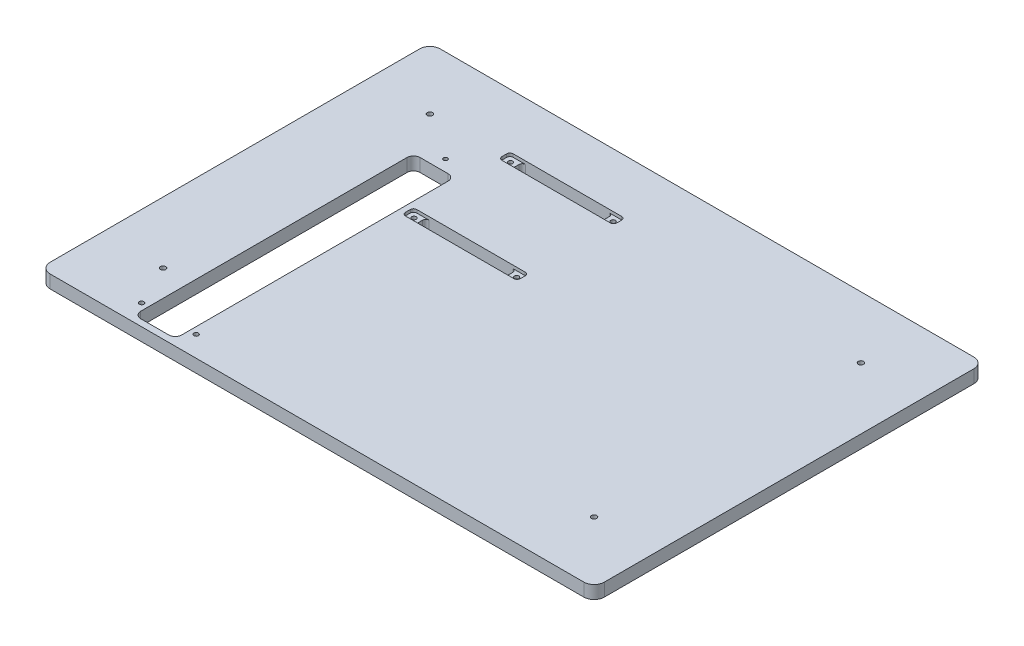
from build123d import *

# Parameters (mm, degrees)
BOSS_EXTRUDE1_DEPTH         = 12.7
TAP_DRILL_FOR_1_4_20_TAP1_D = 5.1054
SKETCH10_R                  = 2.25
SKETCH10_R_2                = 2.2
CUT_EXTRUDE1_DEPTH          = 331.395656751
CUT_EXTRUDE2_REACH          = 332.396
SKETCH11_W                  = 88
SKETCH11_H                  = 11
SKETCH12_W                  = 40
SKETCH12_H                  = 272.22
CUT_EXTRUDE3_DEPTH          = 331.395656751
SKETCH13_W                  = 12
SKETCH13_H                  = 11
CUT_EXTRUDE4_DEPTH          = 3
FILLET2_R                   = 6.35
FILLET3_R                   = 3.175
SKETCH14_R                  = 2
CUT_EXTRUDE5_DEPTH          = 331.395656751


with BuildPart() as part:
    # Sketch1 → Boss-Extrude1 (new body)
    with BuildSketch(Plane(origin=(0, 0, 0), x_dir=(1, 0, 0), z_dir=(0, 1, 0))):
        with BuildLine():
            Line((-260, 190), (260, 190))
            ThreePointArc((260, 190), (267.071067812, 187.071067812), (270, 180))
            Line((270, 180), (270, -180))
            ThreePointArc((270, -180), (267.071067812, -187.071067812), (260, -190))
            Line((260, -190), (-260, -190))
            ThreePointArc((-260, -190), (-267.071067812, -187.071067812), (-270, -180))
            Line((-270, -180), (-270, 180))
            ThreePointArc((-270, 180), (-267.071067812, 187.071067812), (-260, 190))
        make_face()
    extrude(amount=-BOSS_EXTRUDE1_DEPTH)

    # Tap Drill for 1/4-20 Tap1 (through all)
    with Locations(Plane(origin=(0, 0, 0), x_dir=(1, 0, 0), z_dir=(0, 1, 0))):
        with Locations((-210, 130), (-210, -130), (210, 130), (210, -130)):
            Hole(TAP_DRILL_FOR_1_4_20_TAP1_D / 2)

    # Sketch10 → Cut-Extrude1 (cut, through all)
    with BuildSketch(Plane(origin=(0, 0, 0), x_dir=(1, 0, 0), z_dir=(0, 1, 0))):
        with Locations(Location((-137.95, -169.854932, 0), (0, 0, 270))):
            Circle(SKETCH10_R)
        with Locations(Location((-191.05, -169.854932, 0), (0, 0, 270))):
            Circle(SKETCH10_R)
        with Locations(Location((-133, 131.522913005, 0), (0, 0, 270))):
            Circle(SKETCH10_R_2)
        with Locations(Location((-33, 131.522913005, 0), (0, 0, 270))):
            Circle(SKETCH10_R_2)
        with Locations(Location((-133, 37.522913005, 0), (0, 0, 270))):
            Circle(SKETCH10_R_2)
        with Locations(Location((-33, 37.522913005, 0), (0, 0, 270))):
            Circle(SKETCH10_R_2)
    extrude(amount=-CUT_EXTRUDE1_DEPTH, mode=Mode.SUBTRACT)

    # Sketch11 → Cut-Extrude2 (cut, up to next)
    with BuildSketch(Plane(origin=(0, 0, 0), x_dir=(1, 0, 0), z_dir=(0, 1, 0)), mode=Mode.PRIVATE) as cut_extrude2_sk1:
        with Locations((-83, 37.522913005)):
            Rectangle(SKETCH11_W, SKETCH11_H)
    cut_extrude2_tool1 = extrude(cut_extrude2_sk1.sketch, amount=-CUT_EXTRUDE2_REACH, mode=Mode.PRIVATE) & part.part
    # Sketch11 → Cut-Extrude2 (cut, up to next)
    with BuildSketch(Plane(origin=(0, 0, 0), x_dir=(1, 0, 0), z_dir=(0, 1, 0)), mode=Mode.PRIVATE) as cut_extrude2_sk2:
        with Locations((-83, 131.522913005)):
            Rectangle(SKETCH11_W, SKETCH11_H)
    cut_extrude2_tool2 = extrude(cut_extrude2_sk2.sketch, amount=-CUT_EXTRUDE2_REACH, mode=Mode.PRIVATE) & part.part
    add(cut_extrude2_tool1.solids().sort_by_distance((-83, 0, -37.522913))[0], mode=Mode.SUBTRACT)
    add(cut_extrude2_tool2.solids().sort_by_distance((-83, 0, -131.522913))[0], mode=Mode.SUBTRACT)

    # Sketch12 → Cut-Extrude3 (cut, through all)
    with BuildSketch(Plane(origin=(0, 0, 0), x_dir=(1, 0, 0), z_dir=(0, 1, 0))):
        with Locations((-164.5, -47.569932)):
            Rectangle(SKETCH12_W, SKETCH12_H)
    extrude(amount=-CUT_EXTRUDE3_DEPTH, mode=Mode.SUBTRACT)

    # Sketch13 → Cut-Extrude4 (cut)
    with BuildSketch(Plane(origin=(0, 0, 0), x_dir=(1, 0, 0), z_dir=(0, 1, 0))):
        with Locations((-33, 37.522913005)):
            Rectangle(SKETCH13_W, SKETCH13_H)
        with Locations((-33, 131.522913005)):
            Rectangle(SKETCH13_W, SKETCH13_H)
        with Locations((-133, 37.522913005)):
            Rectangle(SKETCH13_W, SKETCH13_H)
        with Locations((-133, 131.522913005)):
            Rectangle(SKETCH13_W, SKETCH13_H)
    extrude(amount=-CUT_EXTRUDE4_DEPTH, mode=Mode.SUBTRACT)

    # Fillet2
    fillet2_edges = [part.edges().sort_by_distance(p)[0] for p in [
        (-144.5, -6.35, -88.540068),
        (-144.5, -6.35, 183.679932),
        (-184.5, -6.35, 183.679932),
        (-184.5, -6.35, -88.540068),
    ]]
    fillet(fillet2_edges, radius=FILLET2_R)

    # Fillet3
    fillet3_edges = [part.edges().sort_by_distance(p)[0] for p in [
        (-127, -7.85, -32.022913005),
        (-127, -7.85, -43.022913005),
        (-39, -7.85, -43.022913005),
        (-39, -7.85, -32.022913005),
        (-39, -7.85, -137.022913005),
        (-39, -7.85, -126.022913005),
        (-127, -7.85, -126.022913005),
        (-127, -7.85, -137.022913005),
        (-27, -1.5, -137.022913005),
        (-27, -1.5, -126.022913005),
        (-139, -1.5, -32.022913005),
        (-139, -1.5, -43.022913005),
        (-139, -1.5, -126.022913005),
        (-139, -1.5, -137.022913005),
        (-27, -1.5, -43.022913005),
        (-27, -1.5, -32.022913005),
    ]]
    fillet(fillet3_edges, radius=FILLET3_R)

    # Sketch14 → Cut-Extrude5 (cut, through all)
    with BuildSketch(Plane(origin=(0, 0, 0), x_dir=(1, 0, 0), z_dir=(0, 1, 0))):
        with Locations(Location((-164.5, 99.715068, 0), (0, 0, 270))):
            Circle(SKETCH14_R)
    extrude(amount=-CUT_EXTRUDE5_DEPTH, mode=Mode.SUBTRACT)


solid = part.part
